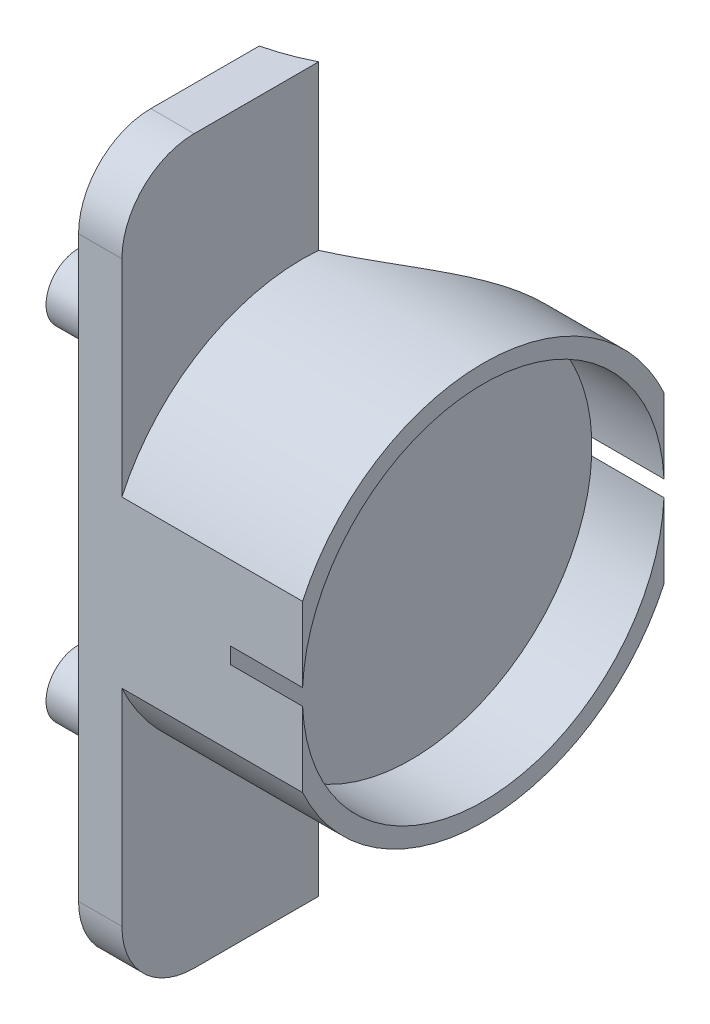
from build123d import *

# Parameters (mm, degrees)
SKETCH1_W               = 20
SKETCH1_H               = 10
BOSS_EXTRUDE1_DEPTH     = 6.2
SKETCH2_R               = 0.9
BOSS_EXTRUDE2_DEPTH     = 2
FILLET1_R               = 2
CUT_EXTRUDE1_DEPTH      = 14.86506401
CUT_EXTRUDE1_DEPTH_BACK = 2
SKETCH3_R               = 5.005
CUT_EXTRUDE2_DEPTH      = 13.784365452
CUT_EXTRUDE2_DEPTH_BACK = 13.784365452
CUT_EXTRUDE3_DEPTH      = 5


with BuildPart() as part:
    # Sketch1 → Boss-Extrude1 (new body)
    with BuildSketch(Plane.YZ):
        Rectangle(SKETCH1_W, SKETCH1_H)
    extrude(amount=BOSS_EXTRUDE1_DEPTH)

    # Sketch2 → Boss-Extrude2 (add)
    with BuildSketch(Plane.YZ):
        with Locations(Location((-4.75, 3, 0), (0, 0, 270))):
            Circle(SKETCH2_R)
        with Locations(Location((4.75, 3, 0), (0, 0, 90))):
            Circle(SKETCH2_R)
    extrude(amount=-BOSS_EXTRUDE2_DEPTH)

    # Fillet1
    fillet1_edges = [part.edges().sort_by_distance(p)[0] for p in [
        (3.1, -10, 5),
        (3.1, 10, 5),
    ]]
    fillet(fillet1_edges, radius=FILLET1_R)

    # Sketch3 → Cut-Extrude1 (cut, two sides: drawn at the far end of the back side and taken through both)
    with BuildSketch(Plane.YZ.offset(6.2).offset(-CUT_EXTRUDE1_DEPTH_BACK)):
        Circle(SKETCH3_R)
    extrude(amount=CUT_EXTRUDE1_DEPTH + CUT_EXTRUDE1_DEPTH_BACK, mode=Mode.SUBTRACT)

    # Sketch4 → Cut-Extrude2 (cut, two sides: drawn at the far end of the back side and taken through both)
    with BuildSketch(Plane(origin=(0, 0, 0), x_dir=(-1, 0, 0), z_dir=(0, 1, 0)).offset(-CUT_EXTRUDE2_DEPTH_BACK)):
        with BuildLine():
            Line((-4.2, -5), (0, -5))
            Line((0, -5), (0, 0))
            ThreePointArc((0, 0), (-2.922321699, -1.809249773), (-4.2, -5))
        make_face()
    extrude(amount=CUT_EXTRUDE2_DEPTH + CUT_EXTRUDE2_DEPTH_BACK, mode=Mode.SUBTRACT)

    # Sketch5 → Cut-Extrude3 (cut)
    with BuildSketch(Plane.YZ.offset(6.2)):
        with BuildLine():
            Line((-10, 5), (-2.291287847, 5))
            ThreePointArc((-2.291287847, 5), (-5.5, 0), (-2.291287847, -5))
            Line((-2.291287847, -5), (-10, -5))
            Line((-10, -5), (-10, 5))
        make_face()
        with BuildLine():
            Line((10, 5), (10, -5))
            Line((10, -5), (2.291287847, -5))
            ThreePointArc((2.291287847, -5), (5.5, 0), (2.291287847, 5))
            Line((2.291287847, 5), (10, 5))
        make_face()
    extrude(amount=-CUT_EXTRUDE3_DEPTH, mode=Mode.SUBTRACT)


solid = part.part
